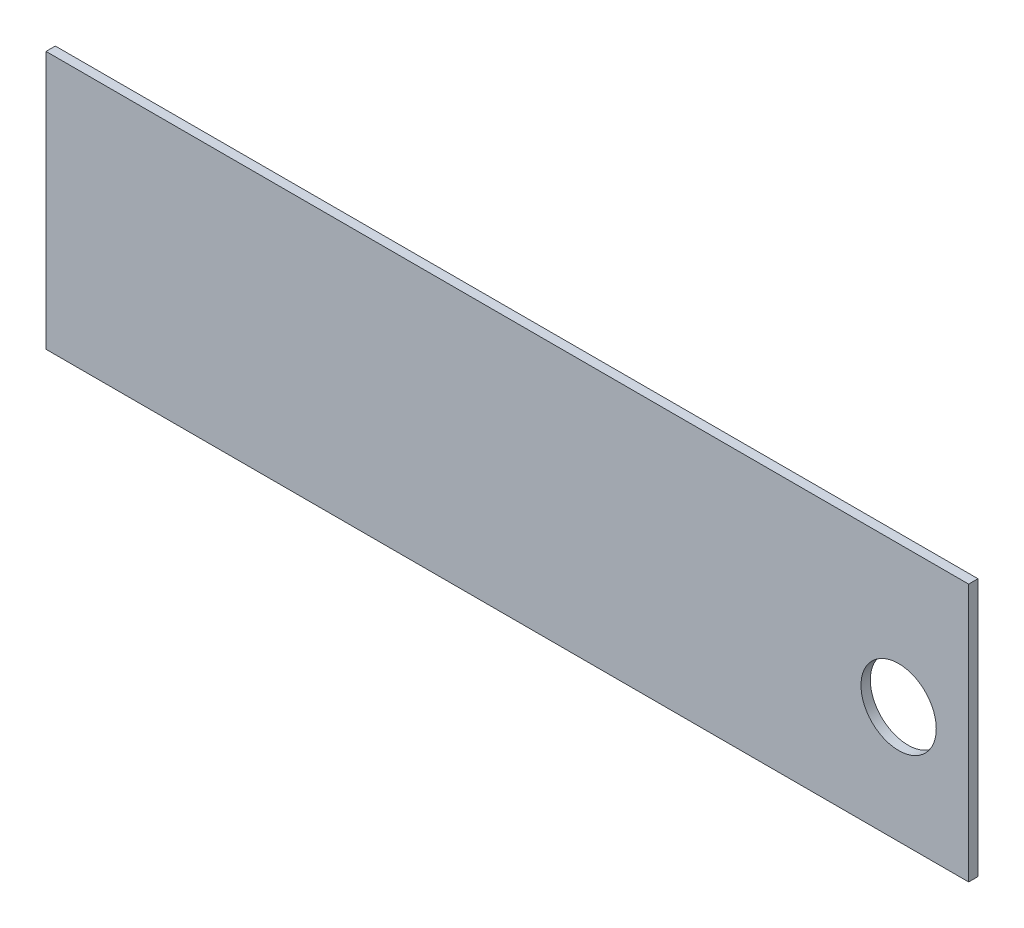
from build123d import *

# Parameters (mm, degrees)
SKETCH2_W           = 77.34
SKETCH2_H           = 87.37
BOSS_EXTRUDE1_DEPTH = 3.16
SKETCH_3_W          = 3.16
SKETCH_3_H          = 87.37
EXTRUDE_3_DEPTH     = 80
SKETCH_4_W          = 3.16
SKETCH_4_H          = 87.37
EXTRUDE_4_DEPTH     = 60
SKETCH_5_W          = 3.16
SKETCH_5_H          = 87.37
EXTRUDE_5_DEPTH     = 113
SKETCH_6_W          = 3.16
SKETCH_6_H          = 87.37
CUT_EXTRUDE_1_DEPTH = 17.86
SKETCH_8_R          = 12.75
CUT_EXTRUDE_2_DEPTH = 10


with BuildPart() as part:
    # Sketch2 → Boss-Extrude1 (new body)
    with BuildSketch(Plane.XY):
        with Locations((-14.294928595, 27.706753385)):
            Rectangle(SKETCH2_W, SKETCH2_H)
    extrude(amount=BOSS_EXTRUDE1_DEPTH)

    # 草图3 → 凸台-拉伸3 (add)
    with BuildSketch(Plane(origin=(24.375071405, 0, 0), x_dir=(0, 0, -1), z_dir=(1, 0, 0))):
        with Locations((-1.58, 27.706753385)):
            Rectangle(SKETCH_3_W, SKETCH_3_H)
    extrude(amount=EXTRUDE_3_DEPTH)

    # 草图4 → 凸台-拉伸4 (add)
    with BuildSketch(Plane.ZY.offset(52.964928595)):
        with Locations((1.58, 27.706753385)):
            Rectangle(SKETCH_4_W, SKETCH_4_H)
    extrude(amount=EXTRUDE_4_DEPTH)

    # 草图5 → 凸台-拉伸5 (add)
    with BuildSketch(Plane(origin=(104.375071405, 0, 0), x_dir=(0, 0, -1), z_dir=(1, 0, 0))):
        with Locations((-1.58, 27.706753385)):
            Rectangle(SKETCH_5_W, SKETCH_5_H)
    extrude(amount=EXTRUDE_5_DEPTH)

    # 草图6 → 切除-拉伸1 (cut)
    with BuildSketch(Plane(origin=(217.375071405, 0, 0), x_dir=(0, 0, -1), z_dir=(1, 0, 0))):
        with Locations((-1.58, 27.706753385)):
            Rectangle(SKETCH_6_W, SKETCH_6_H)
    extrude(amount=-CUT_EXTRUDE_1_DEPTH, mode=Mode.SUBTRACT)

    # 草图8 → 切除-拉伸2 (cut)
    with BuildSketch(Plane.XY.offset(3.16)):
        with Locations((175.79355983, 23.47529756)):
            Circle(SKETCH_8_R)
    extrude(amount=-CUT_EXTRUDE_2_DEPTH, mode=Mode.SUBTRACT)


solid = part.part
